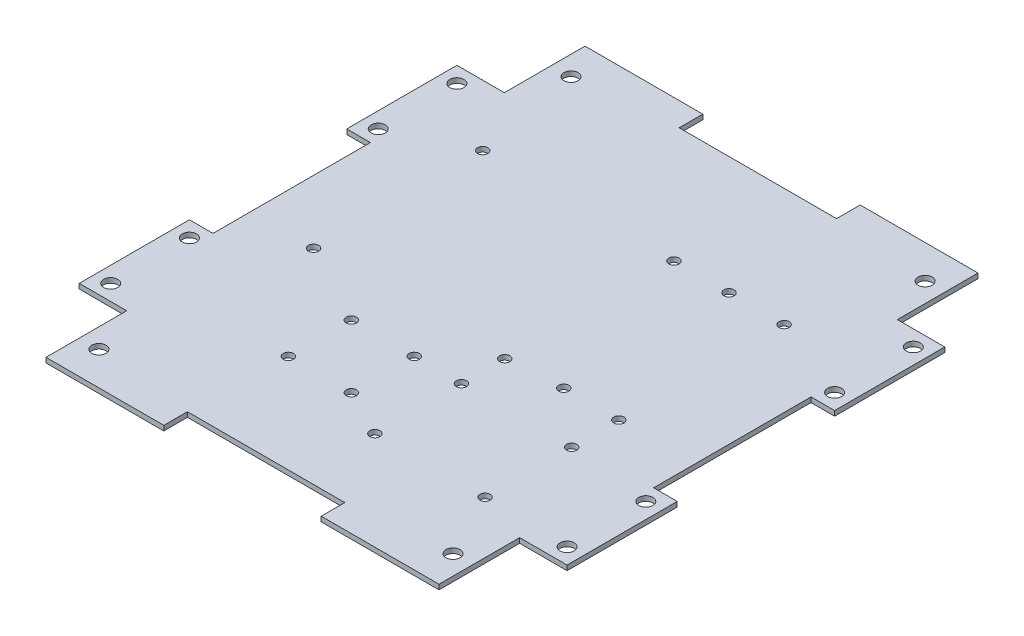
from build123d import *

# Parameters (mm, degrees)
SKETCH1_R                     = 2.286
BOSS_EXTRUDE1_DEPTH           = 1.5875
SKETCH2_R                     = 2.286
CUT_EXTRUDE1_DEPTH            = 118.348360795
SKETCH3_R                     = 1.651
LIPO_HOLDER_HOLES_DEPTH       = 118.348360795
SKETCH4_R                     = 1.651
LORA_THING_PLUS_DEPTH         = 118.348360795
GPS_BREAKOUT_BOARD_DEPTH      = 118.348360795
GPS_BREAKOUT_BOARD_DEPTH_BACK = 118.348360795
SKETCH5_R                     = 1.651
SKETCH6_R                     = 1.651
CUT_EXTRUDE4_DEPTH            = 118.348360795


with BuildPart() as part:
    # Sketch1 → Boss-Extrude1 (new body)
    with BuildSketch(Plane(origin=(0, 0, 0), x_dir=(1, 0, 0), z_dir=(0, 1, 0))):
        Polygon((-25.4, 86.995), (-63.43142, 86.995), (-63.43142, 60.96), (-78.74, 60.96), (-78.74, 25.4), (-71.12, 25.4), (-71.12, -25.4), (-78.74, -25.4), (-78.74, -60.96), (-63.43142, -60.96), (-63.43142, -86.995), (-25.4, -86.995), (-25.4, -79.375), (25.4, -79.375), (25.4, -86.995), (63.43142, -86.995), (63.43142, -60.96), (78.74, -60.96), (78.74, -25.4), (71.12, -25.4), (71.12, 25.4), (78.74, 25.4), (78.74, 60.96), (63.43142, 60.96), (63.43142, 86.995), (25.4, 86.995), (25.4, 79.375), (-25.4, 79.375), align=None)
        with Locations(Location((-57.15, 76.2, 0), (0, 0, 270))):
            Circle(SKETCH1_R, mode=Mode.SUBTRACT)
        with Locations(Location((57.15, 76.2, 0), (0, 0, 270))):
            Circle(SKETCH1_R, mode=Mode.SUBTRACT)
        with Locations(Location((57.15, -76.2, 0), (0, 0, 270))):
            Circle(SKETCH1_R, mode=Mode.SUBTRACT)
        with Locations(Location((-57.15, -76.2, 0), (0, 0, 270))):
            Circle(SKETCH1_R, mode=Mode.SUBTRACT)
    extrude(amount=BOSS_EXTRUDE1_DEPTH)

    # Sketch2 → Cut-Extrude1 (cut, through all)
    with BuildSketch(Plane(origin=(0, 1.5875, 0), x_dir=(1, 0, 0), z_dir=(0, 1, 0))):
        with Locations(Location((-73.66, -30.48, 0), (0, 0, 270))):
            Circle(SKETCH2_R)
        with Locations(Location((-73.66, -55.88, 0), (0, 0, 270))):
            Circle(SKETCH2_R)
        with Locations(Location((73.66, -55.88, 0), (0, 0, 90))):
            Circle(SKETCH2_R)
        with Locations(Location((73.66, -30.48, 0), (0, 0, 90))):
            Circle(SKETCH2_R)
        with Locations(Location((73.66, 30.48, 0), (0, 0, 270))):
            Circle(SKETCH2_R)
        with Locations(Location((73.66, 55.88, 0), (0, 0, 270))):
            Circle(SKETCH2_R)
        with Locations(Location((-73.66, 55.88, 0), (0, 0, 90))):
            Circle(SKETCH2_R)
        with Locations(Location((-73.66, 30.48, 0), (0, 0, 90))):
            Circle(SKETCH2_R)
    extrude(amount=-CUT_EXTRUDE1_DEPTH, mode=Mode.SUBTRACT)

    # Sketch3 → Lipo Holder Holes (cut, through all)
    with BuildSketch(Plane(origin=(0, 1.5875, 0), x_dir=(1, 0, 0), z_dir=(0, 1, 0))):
        with Locations(Location((-50.73142, 41.275, 0), (0, 0, 270))):
            Circle(SKETCH3_R)
        with Locations(Location((10.99058, 41.275, 0), (0, 0, 270))):
            Circle(SKETCH3_R)
        with Locations(Location((10.99058, -13.335, 0), (0, 0, 270))):
            Circle(SKETCH3_R)
        with Locations(Location((-50.73142, -13.335, 0), (0, 0, 270))):
            Circle(SKETCH3_R)
    extrude(amount=-LIPO_HOLDER_HOLES_DEPTH, mode=Mode.SUBTRACT)

    # Sketch4 → LoRa Thing Plus (cut, through all)
    with BuildSketch(Plane(origin=(0, 1.5875, 0), x_dir=(1, 0, 0), z_dir=(0, 1, 0))):
        with Locations(Location((28.77058, 41.275, 0), (0, 0, 270))):
            Circle(SKETCH4_R)
        with Locations(Location((46.55058, 41.275, 0), (0, 0, 270))):
            Circle(SKETCH4_R)
        with Locations(Location((46.55058, -12.065, 0), (0, 0, 270))):
            Circle(SKETCH4_R)
        with Locations(Location((28.77058, -12.065, 0), (0, 0, 270))):
            Circle(SKETCH4_R)
        with Locations(Location((10.99058, 41.275, 0), (0, 0, 270))):
            Circle(SKETCH4_R)
    extrude(amount=-LORA_THING_PLUS_DEPTH, mode=Mode.SUBTRACT)

    # Sketch5 → GPS Breakout Board (cut, two sides: drawn at the far end of the back side and taken through both)
    with BuildSketch(Plane(origin=(0, 1.5875, 0), x_dir=(1, 0, 0), z_dir=(0, 1, 0)).offset(-GPS_BREAKOUT_BOARD_DEPTH_BACK)):
        with Locations(Location((46.55058, -55.245, 0), (0, 0, 270))):
            Circle(SKETCH5_R)
        with Locations(Location((10.99058, -55.245, 0), (0, 0, 270))):
            Circle(SKETCH5_R)
        with Locations(Location((10.99058, -27.305, 0), (0, 0, 270))):
            Circle(SKETCH5_R)
        with Locations(Location((46.55058, -27.305, 0), (0, 0, 270))):
            Circle(SKETCH5_R)
        with Locations(Location((46.55058, -12.065, 0), (0, 0, 270))):
            Circle(SKETCH5_R)
    extrude(amount=GPS_BREAKOUT_BOARD_DEPTH + GPS_BREAKOUT_BOARD_DEPTH_BACK, mode=Mode.SUBTRACT)

    # Sketch6 → Cut-Extrude4 (cut, through all)
    with BuildSketch(Plane(origin=(0, 1.5875, 0), x_dir=(1, 0, 0), z_dir=(0, 1, 0))):
        with Locations(Location((-4.24942, -47.625, 0), (0, 0, 270))):
            Circle(SKETCH6_R)
        with Locations(Location((-24.56942, -47.625, 0), (0, 0, 270))):
            Circle(SKETCH6_R)
        with Locations(Location((-24.56942, -27.305, 0), (0, 0, 270))):
            Circle(SKETCH6_R)
        with Locations(Location((-4.24942, -27.305, 0), (0, 0, 270))):
            Circle(SKETCH6_R)
        with Locations(Location((10.99058, -27.305, 0), (0, 0, 270))):
            Circle(SKETCH6_R)
    extrude(amount=-CUT_EXTRUDE4_DEPTH, mode=Mode.SUBTRACT)


solid = part.part
